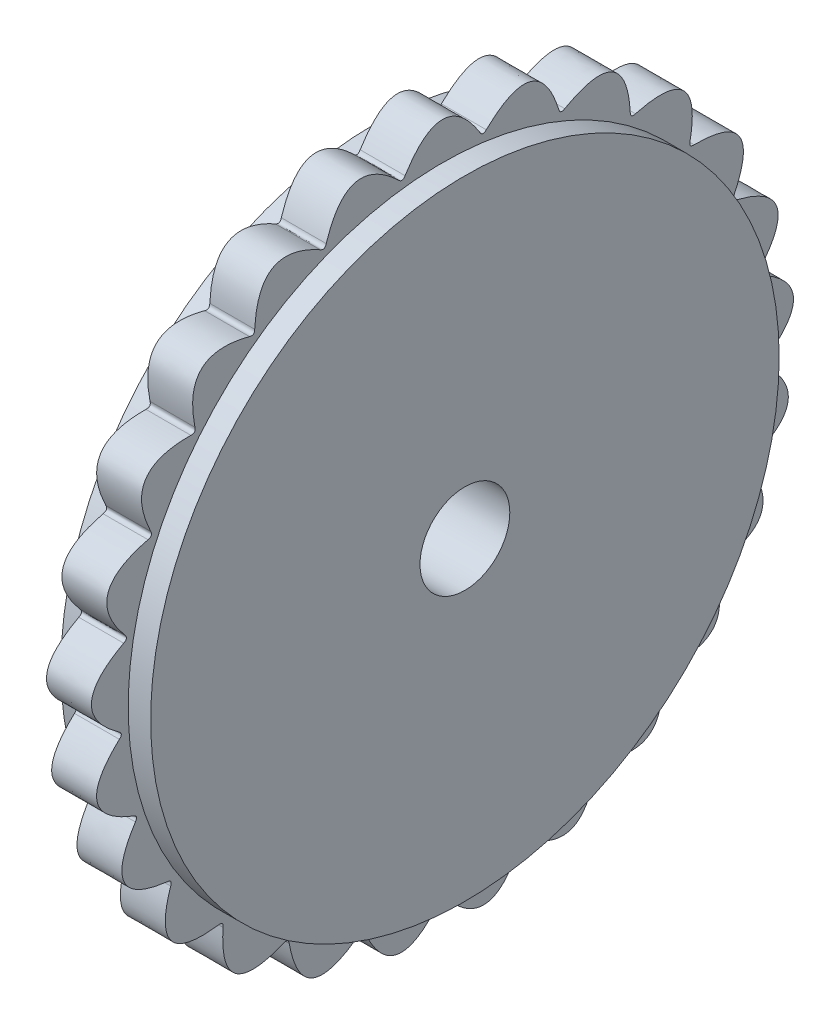
from build123d import *

# Parameters (mm, degrees)
SKETCH3_R           = 3
BOSS_EXTRUDE1_DEPTH = 3
SKETCH5_R           = 21
SKETCH5_R_2         = 3
BOSS_EXTRUDE2_DEPTH = 1.5
BOSS_EXTRUDE3_START = 1.5
SKETCH6_R           = 21
SKETCH6_R_2         = 3
BOSS_EXTRUDE3_DEPTH = 1.5


with BuildPart() as part:
    # Sketch3 → Boss-Extrude1 (new body)
    with BuildSketch(Plane(origin=(0, 0, 0), x_dir=(0, 0, -1), z_dir=(1, 0, 0))):
        with BuildLine():
            add(Edge.make_bspline(
                [(-2.5, 21.5), (0, 25.5), (2.5, 21.5)],
                knots=[0, 0, 0, 1, 1, 1], degree=2))
            add(Edge.make_bspline(
                [(2.5, 21.5), (2.682302846, 21.186826024), (2.925374671, 21.446262682)],
                knots=[0, 0, 0, 1, 1, 1], degree=2))
            add(Edge.make_bspline(
                [(2.925374671, 21.446262682), (6.341592123, 24.698870609), (7.768290477, 20.202813246)],
                knots=[0, 0, 0, 1, 1, 1], degree=2))
            add(Edge.make_bspline(
                [(7.768290477, 20.202813246), (7.866982743, 19.854141333), (8.166937293, 20.044977806)],
                knots=[0, 0, 0, 1, 1, 1], degree=2))
            add(Edge.make_bspline(
                [(8.166937293, 20.044977806), (12.28471869, 22.345820341), (12.548470693, 17.636209436)],
                knots=[0, 0, 0, 1, 1, 1], degree=2))
            add(Edge.make_bspline(
                [(12.548470693, 17.636209436), (12.557351182, 17.273947923), (12.895341209, 17.384193254)],
                knots=[0, 0, 0, 1, 1, 1], degree=2))
            add(Edge.make_bspline(
                [(12.895341209, 17.384193254), (17.455951201, 18.588699999), (16.540184346, 13.961457725)],
                knots=[0, 0, 0, 1, 1, 1], degree=2))
            add(Edge.make_bspline(
                [(16.540184346, 13.961457725), (16.458695063, 13.608368836), (16.813483411, 13.631095906)],
                knots=[0, 0, 0, 1, 1, 1], degree=2))
            add(Edge.make_bspline(
                [(16.813483411, 13.631095906), (21.5303621, 13.663583272), (19.492617386, 9.409456278)],
                knots=[0, 0, 0, 1, 1, 1], degree=2))
            add(Edge.make_bspline(
                [(19.492617386, 9.409456278), (19.325878602, 9.087725887), (19.675172614, 9.02150667)],
                knots=[0, 0, 0, 1, 1, 1], degree=2))
            add(Edge.make_bspline(
                [(19.675172614, 9.02150667), (24.251941166, 7.879933357), (21.220257586, 4.266224088)],
                knots=[0, 0, 0, 1, 1, 1], degree=2))
            add(Edge.make_bspline(
                [(21.220257586, 4.266224088), (20.978746114, 3.996067698), (21.300598362, 3.845062991)],
                knots=[0, 0, 0, 1, 1, 1], degree=2))
            add(Edge.make_bspline(
                [(21.300598362, 3.845062991), (25.449681575, 1.601158248), (21.61455096, -1.145070651)],
                knots=[0, 0, 0, 1, 1, 1], degree=2))
            add(Edge.make_bspline(
                [(21.61455096, -1.145070651), (21.313441852, -1.346678121), (21.587629177, -1.572980137)],
                knots=[0, 0, 0, 1, 1, 1], degree=2))
            add(Edge.make_bspline(
                [(21.587629177, -1.572980137), (25.048324894, -4.778223522), (20.650722604, -6.48441639)],
                knots=[0, 0, 0, 1, 1, 1], degree=2))
            add(Edge.make_bspline(
                [(20.650722604, -6.48441639), (20.308935654, -6.604807201), (20.518229857, -6.892187137)],
                knots=[0, 0, 0, 1, 1, 1], degree=2))
            add(Edge.make_bspline(
                [(20.518229857, -6.892187137), (23.073089838, -10.857371935), (18.389333399, -11.4163224)],
                knots=[0, 0, 0, 1, 1, 1], degree=2))
            add(Edge.make_bspline(
                [(18.389333399, -11.4163224), (18.028344337, -11.447931953), (18.159594694, -11.778332673)],
                knots=[0, 0, 0, 1, 1, 1], degree=2))
            add(Edge.make_bspline(
                [(18.159594694, -11.778332673), (19.648087691, -16.254311739), (14.972474745, -15.630898887)],
                knots=[0, 0, 0, 1, 1, 1], degree=2))
            add(Edge.make_bspline(
                [(14.972474745, -15.630898887), (14.614965842, -15.571741039), (14.65992541, -15.924402248)],
                knots=[0, 0, 0, 1, 1, 1], degree=2))
            add(Edge.make_bspline(
                [(14.65992541, -15.924402248), (14.988523933, -20.629933357), (10.614840438, -18.86332851)],
                knots=[0, 0, 0, 1, 1, 1], degree=2))
            add(Edge.make_bspline(
                [(10.614840438, -18.86332851), (10.283275294, -18.717120366), (10.239119097, -19.069883065)],
                knots=[0, 0, 0, 1, 1, 1], degree=2))
            add(Edge.make_bspline(
                [(10.239119097, -19.069883065), (9.387176093, -23.70930039), (5.590236668, -20.910505828)],
                knots=[0, 0, 0, 1, 1, 1], degree=2))
            add(Edge.make_bspline(
                [(5.590236668, -20.910505828), (5.305448739, -20.686434184), (5.174951275, -21.017132994)],
                knots=[0, 0, 0, 1, 1, 1], degree=2))
            add(Edge.make_bspline(
                [(5.174951275, -21.017132994), (3.195997456, -25.298924884), (0.214377768, -21.643799162)],
                knots=[0, 0, 0, 1, 1, 1], degree=2))
            add(Edge.make_bspline(
                [(0.214377768, -21.643799162), (-0.005738672, -21.355943262), (-0.214377768, -21.643799162)],
                knots=[0, 0, 0, 1, 1, 1], degree=2))
            add(Edge.make_bspline(
                [(-0.214377768, -21.643799162), (-3.195997456, -25.298924884), (-5.174951275, -21.017132994)],
                knots=[0, 0, 0, 1, 1, 1], degree=2))
            add(Edge.make_bspline(
                [(-5.174951275, -21.017132994), (-5.316565502, -20.683579884), (-5.590236668, -20.910505828)],
                knots=[0, 0, 0, 1, 1, 1], degree=2))
            add(Edge.make_bspline(
                [(-5.590236668, -20.910505828), (-9.387176093, -23.70930039), (-10.239119097, -19.069883065)],
                knots=[0, 0, 0, 1, 1, 1], degree=2))
            add(Edge.make_bspline(
                [(-10.239119097, -19.069883065), (-10.293332967, -18.711591113), (-10.614840438, -18.86332851)],
                knots=[0, 0, 0, 1, 1, 1], degree=2))
            add(Edge.make_bspline(
                [(-10.614840438, -18.86332851), (-14.988523933, -20.629933357), (-14.65992541, -15.924402248)],
                knots=[0, 0, 0, 1, 1, 1], degree=2))
            add(Edge.make_bspline(
                [(-14.65992541, -15.924402248), (-14.623332467, -15.563884256), (-14.972474745, -15.630898887)],
                knots=[0, 0, 0, 1, 1, 1], degree=2))
            add(Edge.make_bspline(
                [(-14.972474745, -15.630898887), (-19.648087691, -16.254311739), (-18.159594694, -11.778332673)],
                knots=[0, 0, 0, 1, 1, 1], degree=2))
            add(Edge.make_bspline(
                [(-18.159594694, -11.778332673), (-18.034494206, -11.438241311), (-18.389333399, -11.4163224)],
                knots=[0, 0, 0, 1, 1, 1], degree=2))
            add(Edge.make_bspline(
                [(-18.389333399, -11.4163224), (-23.073089838, -10.857371935), (-20.518229857, -6.892187137)],
                knots=[0, 0, 0, 1, 1, 1], degree=2))
            add(Edge.make_bspline(
                [(-20.518229857, -6.892187137), (-20.312482348, -6.593891597), (-20.650722604, -6.48441639)],
                knots=[0, 0, 0, 1, 1, 1], degree=2))
            add(Edge.make_bspline(
                [(-20.650722604, -6.48441639), (-25.048324894, -4.778223522), (-21.587629177, -1.572980137)],
                knots=[0, 0, 0, 1, 1, 1], degree=2))
            add(Edge.make_bspline(
                [(-21.587629177, -1.572980137), (-21.314162521, -1.335223424), (-21.61455096, -1.145070651)],
                knots=[0, 0, 0, 1, 1, 1], degree=2))
            add(Edge.make_bspline(
                [(-21.61455096, -1.145070651), (-25.449681575, 1.601158248), (-21.300598362, 3.845062991)],
                knots=[0, 0, 0, 1, 1, 1], degree=2))
            add(Edge.make_bspline(
                [(-21.300598362, 3.845062991), (-20.976595474, 4.007341747), (-21.220257586, 4.266224088)],
                knots=[0, 0, 0, 1, 1, 1], degree=2))
            add(Edge.make_bspline(
                [(-21.220257586, 4.266224088), (-24.251941166, 7.879933357), (-19.675172614, 9.02150667)],
                knots=[0, 0, 0, 1, 1, 1], degree=2))
            add(Edge.make_bspline(
                [(-19.675172614, 9.02150667), (-19.320991787, 9.098110899), (-19.492617386, 9.409456278)],
                knots=[0, 0, 0, 1, 1, 1], degree=2))
            add(Edge.make_bspline(
                [(-19.492617386, 9.409456278), (-21.5303621, 13.663583272), (-16.813483411, 13.631095906)],
                knots=[0, 0, 0, 1, 1, 1], degree=2))
            add(Edge.make_bspline(
                [(-16.813483411, 13.631095906), (-16.451379128, 13.617212282), (-16.540184346, 13.961457725)],
                knots=[0, 0, 0, 1, 1, 1], degree=2))
            add(Edge.make_bspline(
                [(-16.540184346, 13.961457725), (-17.455951201, 18.588699999), (-12.895341209, 17.384193254)],
                knots=[0, 0, 0, 1, 1, 1], degree=2))
            add(Edge.make_bspline(
                [(-12.895341209, 17.384193254), (-12.548065815, 17.280694137), (-12.548470693, 17.636209436)],
                knots=[0, 0, 0, 1, 1, 1], degree=2))
            add(Edge.make_bspline(
                [(-12.548470693, 17.636209436), (-12.28471869, 22.345820341), (-8.166937293, 20.044977806)],
                knots=[0, 0, 0, 1, 1, 1], degree=2))
            add(Edge.make_bspline(
                [(-8.166937293, 20.044977806), (-7.856311378, 19.858366425), (-7.768290477, 20.202813246)],
                knots=[0, 0, 0, 1, 1, 1], degree=2))
            add(Edge.make_bspline(
                [(-7.768290477, 20.202813246), (-6.341592123, 24.698870609), (-2.925374671, 21.446262682)],
                knots=[0, 0, 0, 1, 1, 1], degree=2))
            add(Edge.make_bspline(
                [(-2.925374671, 21.446262682), (-2.670916004, 21.188264517), (-2.5, 21.5)],
                knots=[0, 0, 0, 1, 1, 1], degree=2))
        make_face()
        Circle(SKETCH3_R, mode=Mode.SUBTRACT)
    extrude(amount=BOSS_EXTRUDE1_DEPTH)

    # Sketch5 → Boss-Extrude2 (add)
    with BuildSketch(Plane(origin=(3, 0, 0), x_dir=(0, 0, -1), z_dir=(1, 0, 0))):
        Circle(SKETCH5_R)
        Circle(SKETCH5_R_2, mode=Mode.SUBTRACT)
    extrude(amount=BOSS_EXTRUDE2_DEPTH)

    # Sketch6 → Boss-Extrude3 (add)
    with BuildSketch(Plane.ZY.offset(BOSS_EXTRUDE3_START)):
        with Locations(Location((0, 0, 0), (0, 0, 180))):
            Circle(SKETCH6_R)
        Circle(SKETCH6_R_2, mode=Mode.SUBTRACT)
    extrude(amount=-BOSS_EXTRUDE3_DEPTH)


solid = part.part
